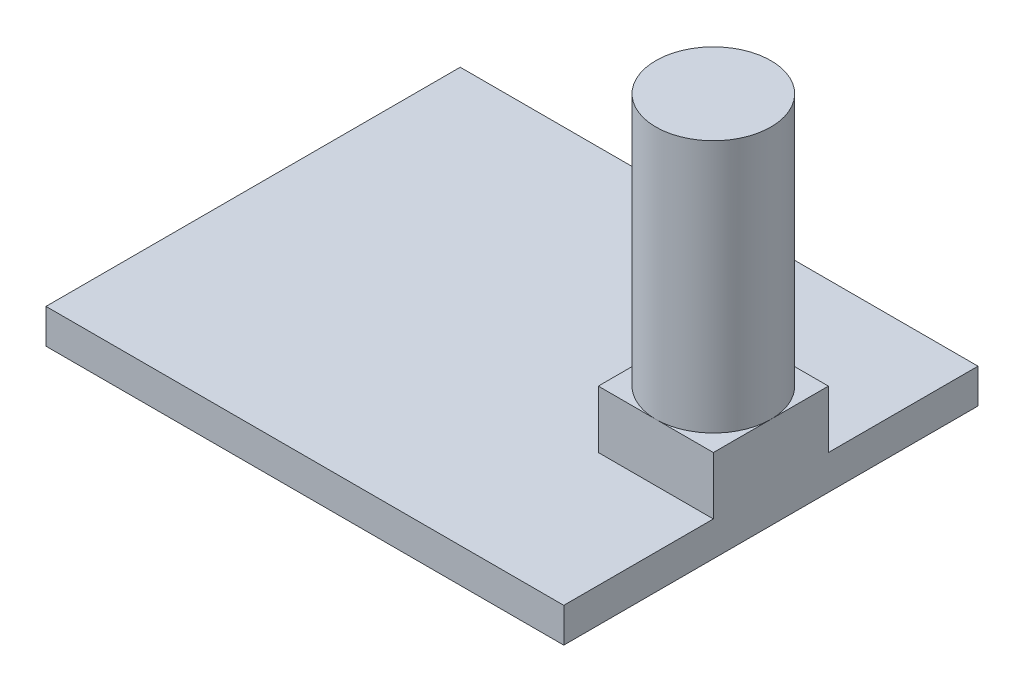
from build123d import *

# Parameters (mm, degrees)
SKETCH1_W           = 45
SKETCH1_H           = 36
BOSS_EXTRUDE1_DEPTH = 3
SKETCH2_W           = 10
SKETCH2_H           = 10
BOSS_EXTRUDE2_DEPTH = 5
SKETCH2_3_R         = 5
BOSS_EXTRUDE3_DEPTH = 27


with BuildPart() as part:
    # Sketch1 → Boss-Extrude1 (new body)
    with BuildSketch(Plane(origin=(0, 0, 0), x_dir=(1, 0, 0), z_dir=(0, 1, 0))):
        Rectangle(SKETCH1_W, SKETCH1_H)
    extrude(amount=BOSS_EXTRUDE1_DEPTH)

    # Sketch2 → Boss-Extrude2 (add)
    with BuildSketch(Plane(origin=(0, 3, 0), x_dir=(1, 0, 0), z_dir=(0, 1, 0))):
        with BuildLine():
            ThreePointArc((17.5, 5), (13.964466095, 3.535533907), (12.5, 4e-09))
            Line((12.5, 0), (22.5, 0))
            ThreePointArc((22.5, 0), (21.035533906, 3.535533906), (17.5, 5))
        make_face()
        with BuildLine():
            Line((22.5, 0), (12.5, 0))
            ThreePointArc((12.5, 4e-09), (13.964466099, -3.535533911), (17.500000019, -5))
            ThreePointArc((17.500000019, -5), (21.035533913, -3.535533899), (22.5, 0))
        make_face()
        with Locations((17.5, 0)):
            Rectangle(SKETCH2_W, SKETCH2_H)
    extrude(amount=BOSS_EXTRUDE2_DEPTH)

    # Sketch2<3> → Boss-Extrude3 (add)
    with BuildSketch(Plane(origin=(0, 3, 0), x_dir=(1, 0, 0), z_dir=(0, 1, 0))):
        with Locations(Location((17.5, 0, 0), (0, 0, 270))):
            Circle(SKETCH2_3_R)
    extrude(amount=BOSS_EXTRUDE3_DEPTH)


solid = part.part
